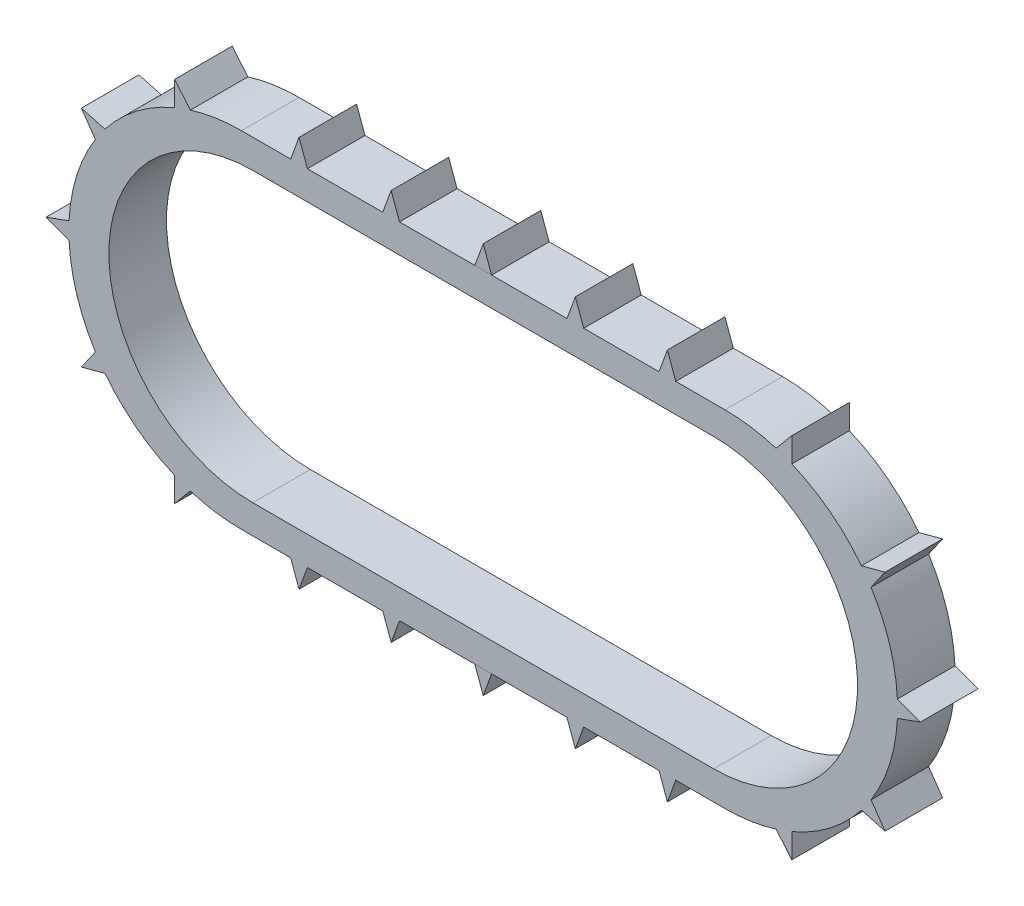
from build123d import *

# Parameters (mm, degrees)
BOSS_EXTRUDE1_DEPTH   = 50
CUT_EXTRUDE1_DEPTH    = 50
BOSS_EXTRUDE2_DEPTH   = 50
BOSS_EXTRUDE2_2_DEPTH = 50
LPATTERN1_COUNT       = 4
LPATTERN1_PITCH       = 80
LPATTERN2_COUNT       = 4
LPATTERN2_PITCH       = 80
BOSS_EXTRUDE3_DEPTH   = 50
CIRPATTERN1_COUNT     = 3
CIRPATTERN1_ANGLE     = 70
CIRPATTERN2_COUNT     = 3
CIRPATTERN2_ANGLE     = 70
MIRROR1_COPY_1_DEPTH  = 50
MIRROR1_COPY_2_DEPTH  = 50
MIRROR1_COPY_3_DEPTH  = 50
MIRROR1_COPY_4_DEPTH  = 50


with BuildPart() as part:
    # Sketch1 → Boss-Extrude1 (new body)
    with BuildSketch(Plane.XY):
        with BuildLine():
            Line((-210, 150), (210, 150))
            ThreePointArc((210, 150), (360, 0), (210, -150))
            Line((210, -150), (-210, -150))
            ThreePointArc((-210, -150), (-360, 0), (-210, 150))
        make_face()
    extrude(amount=BOSS_EXTRUDE1_DEPTH)

    # Sketch2 → Cut-Extrude1 (cut)
    with BuildSketch(Plane.XY.offset(50)):
        with BuildLine():
            Line((200.1935, -125), (-200.1935, -125))
            ThreePointArc((-200.1935, -125), (-325.1935, 0), (-200.1935, 125))
            Line((-200.1935, 125), (200.1935, 125))
            ThreePointArc((200.1935, 125), (325.1935, 0), (200.1935, -125))
        make_face()
    extrude(amount=-CUT_EXTRUDE1_DEPTH, mode=Mode.SUBTRACT)


with BuildPart() as body_2:
    # Sketch3 → Boss-Extrude2 (new body)
    with BuildSketch(Plane.XY):
        Polygon((-7.279404685, 150), (0, 170), (7.279404685, 150), align=None)
    boss_extrude2 = extrude(amount=BOSS_EXTRUDE2_DEPTH)


with BuildPart() as body_3:
    # Sketch3 → Boss-Extrude2 2 (new body)
    with BuildSketch(Plane.XY):
        Polygon((7.279404685, -150), (0, -170), (-7.279404685, -150), align=None)
    boss_extrude2_2 = extrude(amount=BOSS_EXTRUDE2_2_DEPTH)


with BuildPart() as part_1:
    add(part.part)

    # LPattern1: Boss-Extrude2, Boss-Extrude2 2 ×4, 1 skipped
    with Locations(*[(i * LPATTERN1_PITCH, 0, 0) for i in range(1, LPATTERN1_COUNT) if i not in (3,)]):
        add(boss_extrude2)
        add(boss_extrude2_2)

    # LPattern2: Boss-Extrude2, Boss-Extrude2 2 ×4, 1 skipped
    with Locations(*[(-i * LPATTERN2_PITCH, 0, 0) for i in range(1, LPATTERN2_COUNT) if i not in (3,)]):
        add(boss_extrude2)
        add(boss_extrude2_2)

    # Sketch4 → Boss-Extrude3 (add)
    with BuildSketch(Plane.XY.offset(50)):
        Polygon((359.823263439, 7.279404685), (379.823263439, 0), (359.823263439, -7.279404685), align=None)
    boss_extrude3 = extrude(amount=-BOSS_EXTRUDE3_DEPTH)

    # CirPattern1: Boss-Extrude3 ×3 about axis
    cirpattern1_axis = Axis((210, 0, 0), (0, 0, 1))
    for i in range(1, CIRPATTERN1_COUNT):
        add(boss_extrude3.rotate(cirpattern1_axis, i * CIRPATTERN1_ANGLE / (CIRPATTERN1_COUNT - 1)))

    # CirPattern2: Boss-Extrude3 ×3 about axis
    cirpattern2_axis = Axis((210, 0, 0), (0, 0, -1))
    for i in range(1, CIRPATTERN2_COUNT):
        add(boss_extrude3.rotate(cirpattern2_axis, i * CIRPATTERN2_ANGLE / (CIRPATTERN2_COUNT - 1)))

    # Mirror1: Boss-Extrude3 across plane
    add(boss_extrude3.mirror(Plane(origin=(0, 0, 0), x_dir=(0, 0, 1), z_dir=(1, 0, 0))))

    # Mirror1 copy 1 sketch → Mirror1 copy 1 (add)
    with BuildSketch(Plane(origin=(-37.978070699, -120.451051634, 50), x_dir=(-0.819152044288991, 0.5735764363510473, 0), z_dir=(0, 0, 1))):
        Polygon((359.823263439, -7.279404685), (379.823263439, 0), (359.823263439, 7.279404685), align=None)
    extrude(amount=-MIRROR1_COPY_1_DEPTH)

    # Mirror1 copy 2 sketch → Mirror1 copy 2 (add)
    with BuildSketch(Plane(origin=(-138.175769902, -197.335450365, 50), x_dir=(-0.3420201433256661, 0.9396926207859093, 0), z_dir=(0, 0, 1))):
        Polygon((359.823263439, -7.279404685), (379.823263439, 0), (359.823263439, 7.279404685), align=None)
    extrude(amount=-MIRROR1_COPY_2_DEPTH)

    # Mirror1 copy 3 sketch → Mirror1 copy 3 (add)
    with BuildSketch(Plane(origin=(-37.978070699, 120.451051634, 50), x_dir=(-0.819152044288991, -0.5735764363510473, 0), z_dir=(0, 0, 1))):
        Polygon((359.823263439, -7.279404685), (379.823263439, 0), (359.823263439, 7.279404685), align=None)
    extrude(amount=-MIRROR1_COPY_3_DEPTH)

    # Mirror1 copy 4 sketch → Mirror1 copy 4 (add)
    with BuildSketch(Plane(origin=(-138.175769902, 197.335450365, 50), x_dir=(-0.3420201433256661, -0.9396926207859093, 0), z_dir=(0, 0, 1))):
        Polygon((359.823263439, -7.279404685), (379.823263439, 0), (359.823263439, 7.279404685), align=None)
    extrude(amount=-MIRROR1_COPY_4_DEPTH)


solid = Compound([body_2.part, body_3.part, part_1.part])
